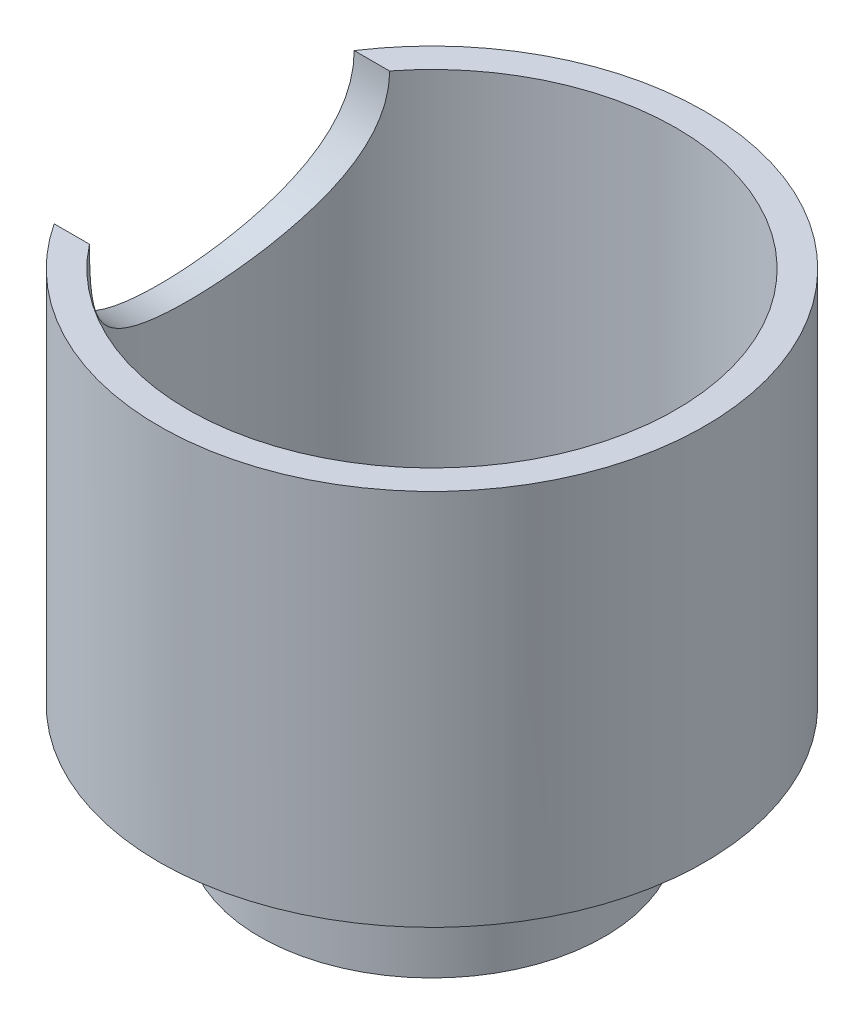
from build123d import *

# Parameters (mm, degrees)
SKETCH3_R          = 10.45
CUT_EXTRUDE1_DEPTH = 44.571665105


with BuildPart() as part:
    # Sketch2 → Revolve1 (revolve)
    with BuildSketch(Plane.XY, mode=Mode.PRIVATE) as revolve1_sk:
        Polygon((10, 0), (10, 10), (17, 10), (17, 34.3), (19, 34.3), (19, 8), (12, 8), (12, 0), align=None)
    revolve(revolve1_sk.sketch.rotate(Axis((0, 0, 0), (0, 1, 0)), 90), axis=Axis((0, 0, 0), (0, 1, 0)))

    # Sketch3 → Cut-Extrude1 (cut, through all)
    with BuildSketch(Plane(origin=(0, 0, 0), x_dir=(0, 0, -1), z_dir=(1, 0, 0))):
        with Locations((0, 34.3)):
            Circle(SKETCH3_R)
    extrude(amount=-CUT_EXTRUDE1_DEPTH, mode=Mode.SUBTRACT)


solid = part.part
